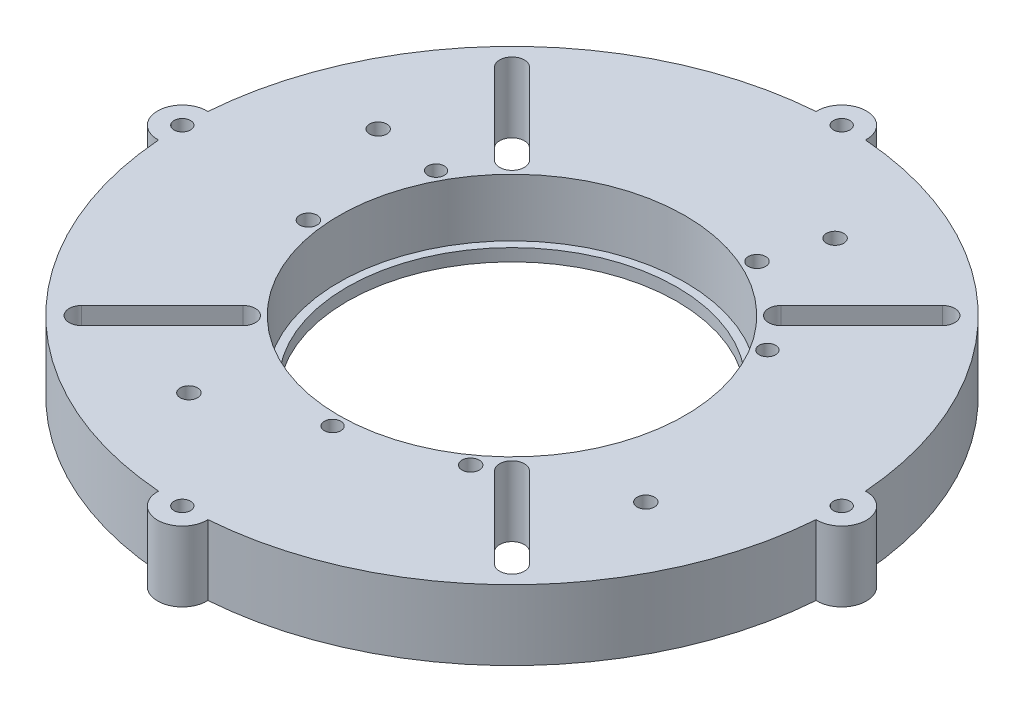
from build123d import *

# Parameters (mm, degrees)
SKETCH1_R                                      = 40
SKETCH1_R_2                                    = 20
BOSS_EXTRUDE1_DEPTH                            = 8.5
SKETCH2_R                                      = 1
CUT_EXTRUDE2_DEPTH                             = 58.203583804
SKETCH2_6_R                                    = 3
SKETCH2_6_R_2                                  = 1
BOSS_EXTRUDE3_DEPTH                            = 8.5
CIRPATTERN1_COUNT                              = 4
CUT_EXTRUDE4_DEPTH                             = 62.402361518
CIRPATTERN3_COUNT                              = 4
SKETCH7_R                                      = 21
CUT_EXTRUDE5_DEPTH                             = 7
SKETCH8_R                                      = 1
OUTER_RETAINER_M2_TAPPED_ENVELOPE_DEPTH        = 4.3
SKETCH9_R                                      = 1
REVB_OLDHAM_FOUR_M2_BLIND_THREAD_MAJOR_DEPTH   = 5.8
SKETCH10_R                                     = 1.51
REVB_OLDHAM_FOUR_D3P02_PILOT_POCKETS_DEPTH     = 1.1
SKETCH11_R                                     = 1.05
BENCH_OUTERRETAINER_M2_THREAD_MAJOR_ENVE_DEPTH = 4
SKETCH12_R                                     = 1.05
BENCH_OLDHAM_M2_CLEARANCE_4X_D2P1_DEPTH        = 9


with BuildPart() as part:
    # Sketch1 → Boss-Extrude1 (new body)
    with BuildSketch(Plane(origin=(0, 0, 0), x_dir=(1, 0, 0), z_dir=(0, 1, 0))):
        Circle(SKETCH1_R)
        Circle(SKETCH1_R_2, mode=Mode.SUBTRACT)
    extrude(amount=BOSS_EXTRUDE1_DEPTH)

    # Sketch2 → Cut-Extrude2 (cut, through all)
    with BuildSketch(Plane(origin=(0, 8.5, 0), x_dir=(1, 0, 0), z_dir=(0, 1, 0))):
        with Locations((40, 0)):
            Circle(SKETCH2_R)
    cut_extrude2 = extrude(amount=-CUT_EXTRUDE2_DEPTH, mode=Mode.SUBTRACT)

    # Sketch2<6> → Boss-Extrude3 (add)
    with BuildSketch(Plane(origin=(0, 8.5, 0), x_dir=(1, 0, 0), z_dir=(0, 1, 0))):
        with Locations((40, 0)):
            Circle(SKETCH2_6_R)
        with Locations((40, 0)):
            Circle(SKETCH2_6_R_2, mode=Mode.SUBTRACT)
    boss_extrude3 = extrude(amount=-BOSS_EXTRUDE3_DEPTH)

    # CirPattern1: Cut-Extrude2, Boss-Extrude3 ×4 about axis
    cirpattern1_axis = Axis((0, 8.5, 0), (0, 1, 0))
    add([cut_extrude2.rotate(cirpattern1_axis, i * 360 / CIRPATTERN1_COUNT) for i in range(1, CIRPATTERN1_COUNT)], mode=Mode.SUBTRACT)
    add([boss_extrude3.rotate(cirpattern1_axis, i * 360 / CIRPATTERN1_COUNT) for i in range(1, CIRPATTERN1_COUNT)])

    # Sketch4 → Cut-Extrude4 (cut, through all)
    with BuildSketch(Plane(origin=(0, 8.5, 0), x_dir=(1, 0, 0), z_dir=(0, 1, 0))):
        with BuildLine():
            Line((-27.170578067, -25.049257724), (-17.377149148, -15.255828804))
            ThreePointArc((-17.377149148, -15.255828804), (-15.255828804, -15.255828804), (-15.255828804, -17.377149148))
            Line((-15.255828804, -17.377149148), (-25.049257724, -27.170578067))
            ThreePointArc((-25.049257724, -27.170578067), (-27.170578067, -27.170578067), (-27.170578067, -25.049257724))
        make_face()
    cut_extrude4 = extrude(amount=-CUT_EXTRUDE4_DEPTH, mode=Mode.SUBTRACT)

    # CirPattern3: Cut-Extrude4 ×4 about axis
    cirpattern3_axis = Axis((0, 8.5, 0), (0, 1, 0))
    for i in range(1, CIRPATTERN3_COUNT):
        add(cut_extrude4.rotate(cirpattern3_axis, i * 360 / CIRPATTERN3_COUNT), mode=Mode.SUBTRACT)

    # Sketch7 → Cut-Extrude5 (cut)
    with BuildSketch(Plane(origin=(0, 8.5, 0), x_dir=(1, 0, 0), z_dir=(0, 1, 0))):
        Circle(SKETCH7_R)
    extrude(amount=-CUT_EXTRUDE5_DEPTH, mode=Mode.SUBTRACT)

    # Sketch8 → Outer_Retainer_M2_Tapped_Envelope (cut)
    with BuildSketch(Plane(origin=(0, 8.5, 0), x_dir=(1, 0, 0), z_dir=(0, 1, 0))):
        with Locations((0.720053396, -22.48847534)):
            Circle(SKETCH8_R)
        with Locations((19.115564239, 11.867822203)):
            Circle(SKETCH8_R)
        with Locations((-19.835617634, 10.620653137)):
            Circle(SKETCH8_R)
    extrude(amount=-OUTER_RETAINER_M2_TAPPED_ENVELOPE_DEPTH, mode=Mode.SUBTRACT)

    # Sketch9 → RevB_Oldham_Four_M2_Blind_Thread_Major (cut)
    with BuildSketch(Plane.XZ):
        with Locations((27.716385975, 11.480502971)):
            Circle(SKETCH9_R)
        with Locations((-11.480502971, 27.716385975)):
            Circle(SKETCH9_R)
        with Locations((-27.716385975, -11.480502971)):
            Circle(SKETCH9_R)
        with Locations((11.480502971, -27.716385975)):
            Circle(SKETCH9_R)
    extrude(amount=-REVB_OLDHAM_FOUR_M2_BLIND_THREAD_MAJOR_DEPTH, mode=Mode.SUBTRACT)

    # Sketch10 → RevB_Oldham_Four_D3p02_Pilot_Pockets (cut)
    with BuildSketch(Plane.XZ):
        with Locations((27.716385975, 11.480502971)):
            Circle(SKETCH10_R)
        with Locations((-11.480502971, 27.716385975)):
            Circle(SKETCH10_R)
        with Locations((-27.716385975, -11.480502971)):
            Circle(SKETCH10_R)
        with Locations((11.480502971, -27.716385975)):
            Circle(SKETCH10_R)
    extrude(amount=-REVB_OLDHAM_FOUR_D3P02_PILOT_POCKETS_DEPTH, mode=Mode.SUBTRACT)

    # Sketch11 → Bench_OuterRetainer_M2_Thread_Major_Envelope_3x_D2p1 (cut)
    with BuildSketch(Plane(origin=(0, 8.5, 0), x_dir=(1, 0, 0), z_dir=(0, 1, 0))):
        with Locations((-22.37980351, -2.32258369)):
            Circle(SKETCH11_R)
        with Locations((13.20131823, -18.22018653)):
            Circle(SKETCH11_R)
        with Locations((9.17848528, 20.54277021)):
            Circle(SKETCH11_R)
    extrude(amount=-BENCH_OUTERRETAINER_M2_THREAD_MAJOR_ENVE_DEPTH, mode=Mode.SUBTRACT)

    # Sketch12 → Bench_Oldham_M2_Clearance_4x_D2p1 (cut)
    with BuildSketch(Plane(origin=(0, 8.5, 0), x_dir=(1, 0, 0), z_dir=(0, 1, 0))):
        with Locations((27.71640367, -11.48048783)):
            Circle(SKETCH12_R)
        with Locations((-11.48048527, -27.71637083)):
            Circle(SKETCH12_R)
        with Locations((-27.71636828, 11.48051812)):
            Circle(SKETCH12_R)
        with Locations((11.48052067, 27.71640112)):
            Circle(SKETCH12_R)
    extrude(amount=-BENCH_OLDHAM_M2_CLEARANCE_4X_D2P1_DEPTH, mode=Mode.SUBTRACT)


solid = part.part
